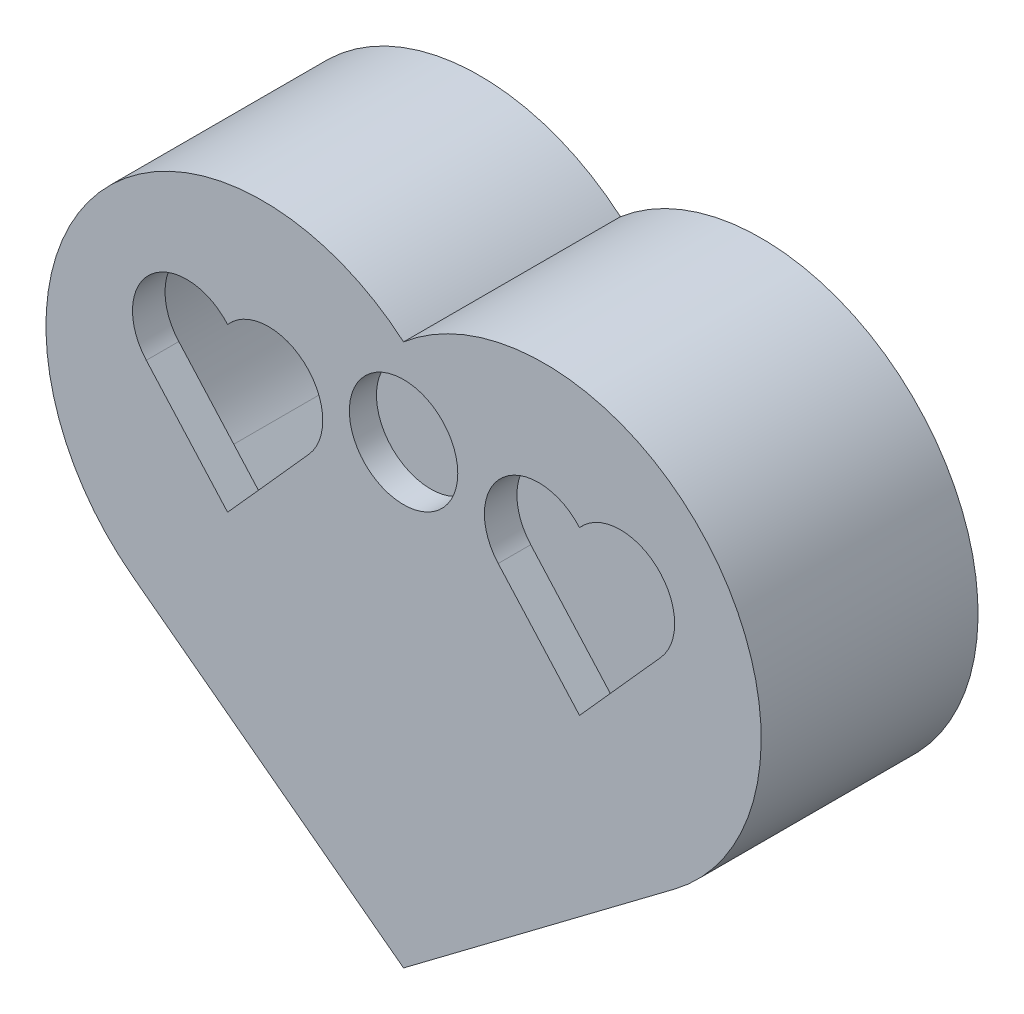
from build123d import *

# Parameters (mm, degrees)
EXTRUDE_1_DEPTH     = 10
SKETCH_2_R          = 5
CUT_EXTRUDE_1_DEPTH = 2.5
CUT_EXTRUDE_2_DEPTH = 7
CUT_EXTRUDE_3_DEPTH = 20


with BuildPart() as part:
    # 草圖1 → 填料-伸長1 (new, symmetric)
    with BuildSketch(Plane.XY):
        with BuildLine():
            Line((-24.197007139, 36.923558221), (0.802992861, 18.124320865))
            Line((0.802992861, 18.124320865), (25.802992861, 36.923558221))
            ThreePointArc((25.802992861, 36.923558221), (29.390613552, 65.414346162), (0.802992861, 68.124320865))
            ThreePointArc((0.802992861, 68.124320865), (-27.78462783, 65.414346162), (-24.197007139, 36.923558221))
        make_face()
    extrude(amount=EXTRUDE_1_DEPTH, both=True)

    # 草圖2 → 除料-伸長1 (cut)
    with BuildSketch(Plane.XY.offset(10)):
        with Locations((0.802992861, 60.124320865)):
            Circle(SKETCH_2_R)
    extrude(amount=-CUT_EXTRUDE_1_DEPTH, mode=Mode.SUBTRACT)

    # 草圖3 → 除料-伸長2 (cut, symmetric)
    with BuildSketch(Plane.XY):
        with BuildLine():
            Line((0.802992861, 20.124320865), (23.302992861, 45.282290118))
            ThreePointArc((23.302992861, 45.282290118), (22.043474428, 66.532077134), (0.802992861, 65.124320865))
            ThreePointArc((0.802992861, 65.124320865), (-20.437488706, 66.532077134), (-21.697007139, 45.282290118))
            Line((-21.697007139, 45.282290118), (0.802992861, 20.124320865))
        make_face()
    extrude(amount=CUT_EXTRUDE_2_DEPTH, both=True, mode=Mode.SUBTRACT)

    # 草圖4 → 除料-伸長3 (cut)
    with BuildSketch(Plane(origin=(0, 0, -10), x_dir=(-1, 0, 0), z_dir=(0, 0, -1))):
        with BuildLine():
            Line((7.923932244, 54.791149812), (15.423932244, 46.405160061))
            Line((15.423932244, 46.405160061), (22.923932244, 54.791149812))
            ThreePointArc((22.923932244, 54.791149812), (22.504092766, 61.874412151), (15.423932244, 61.405160061))
            ThreePointArc((15.423932244, 61.405160061), (8.343771721, 61.874412151), (7.923932244, 54.791149812))
        make_face()
        with BuildLine():
            Line((-17.029917966, 46.405160061), (-24.529917966, 54.791149812))
            ThreePointArc((-24.529917966, 54.791149812), (-24.110078488, 61.874412151), (-17.029917966, 61.405160061))
            ThreePointArc((-17.029917966, 61.405160061), (-9.949757443, 61.874412151), (-9.529917966, 54.791149812))
            Line((-9.529917966, 54.791149812), (-17.029917966, 46.405160061))
        make_face()
    extrude(amount=-CUT_EXTRUDE_3_DEPTH, mode=Mode.SUBTRACT)


solid = part.part
